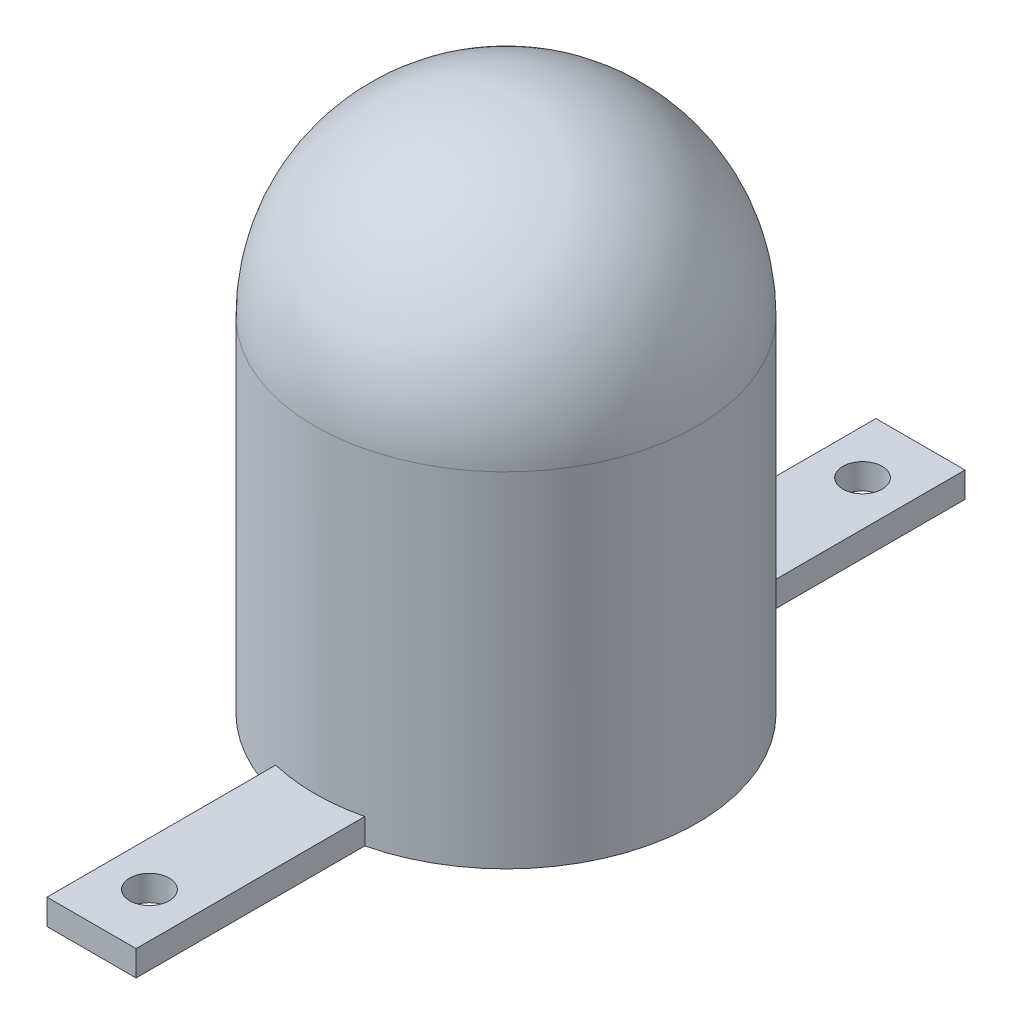
from build123d import *

# Parameters (mm, degrees)
SKETCH1_W           = 7
SKETCH1_H           = 65.1
BOSS_EXTRUDE1_DEPTH = 2
REVOLVE1_ANGLE      = 180
SKETCH3_R           = 15
BOSS_EXTRUDE2_DEPTH = 27
SKETCH4_R           = 1.55
CUT_EXTRUDE1_DEPTH  = 2


with BuildPart() as part:
    # Sketch1 → Boss-Extrude1 (new body)
    with BuildSketch(Plane(origin=(0, 0, 0), x_dir=(1, 0, 0), z_dir=(0, 1, 0))):
        Rectangle(SKETCH1_W, SKETCH1_H)
    extrude(amount=BOSS_EXTRUDE1_DEPTH)



with BuildPart() as body_2:
    # Sketch2 → Revolve1 (revolve)
    with BuildSketch(Plane(origin=(0, 27, 0), x_dir=(1, 0, 0), z_dir=(0, 1, 0))):
        with BuildLine():
            Line((0, 15), (0, -15))
            ThreePointArc((0, -15), (15, 0), (0, 15))
        make_face()
    revolve(axis=Axis((0, 27, -15), (0, 0, 1)), revolution_arc=REVOLVE1_ANGLE)


with BuildPart() as part_1:
    add(part.part)

    add(body_2.part)  # Boss-Extrude2 merges body 2
    # Sketch3 → Boss-Extrude2 (add, through all)
    with BuildSketch(Plane.XZ.offset(-27)):
        with Locations(Location((0, 0, 0), (0, 0, 256.506601178))):
            Circle(SKETCH3_R)
    extrude(amount=BOSS_EXTRUDE2_DEPTH)

    # Sketch4 → Cut-Extrude1 (cut)
    with BuildSketch(Plane(origin=(0, 2, 0), x_dir=(1, 0, 0), z_dir=(0, 1, 0))):
        with Locations(Location((0, -28, 0), (0, 0, 270))):
            Circle(SKETCH4_R)
        with Locations(Location((0, 28, 0), (0, 0, 90))):
            Circle(SKETCH4_R)
    extrude(amount=-CUT_EXTRUDE1_DEPTH, mode=Mode.SUBTRACT)


solid = part_1.part
